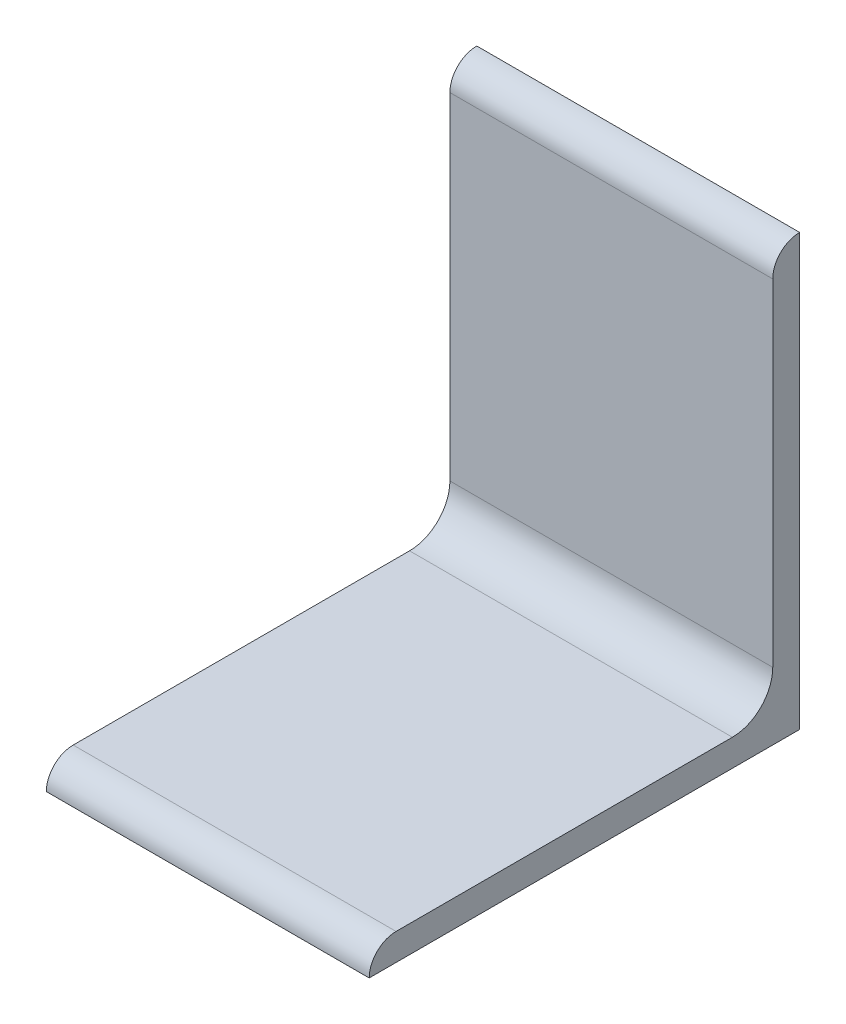
from build123d import *

# Parameters (mm, degrees)
HIERRO_ANGULAR_2_X_2_X_0_125_1_DEPTH = 38.1


with BuildPart() as part:
    # Sketch12 → Hierro angular 2 X 2 X 0.125(1) (new body)
    with BuildSketch(Plane.YZ):
        with BuildLine():
            Line((0, 0), (0, 50.8))
            Line((0, 50.8), (0.00508, 50.8))
            ThreePointArc((0.00508, 50.8), (2.246551928, 49.871551928), (3.175, 47.63008))
            Line((3.175, 47.63008), (3.175, 7.9375))
            ThreePointArc((3.175, 7.9375), (4.569903955, 4.569903955), (7.9375, 3.175))
            Line((7.9375, 3.175), (47.63008, 3.175))
            ThreePointArc((47.63008, 3.175), (49.871551928, 2.246551928), (50.8, 0.00508))
            Line((50.8, 0.00508), (50.8, 0))
            Line((50.8, 0), (0, 0))
        make_face()
    extrude(amount=HIERRO_ANGULAR_2_X_2_X_0_125_1_DEPTH)


solid = part.part
